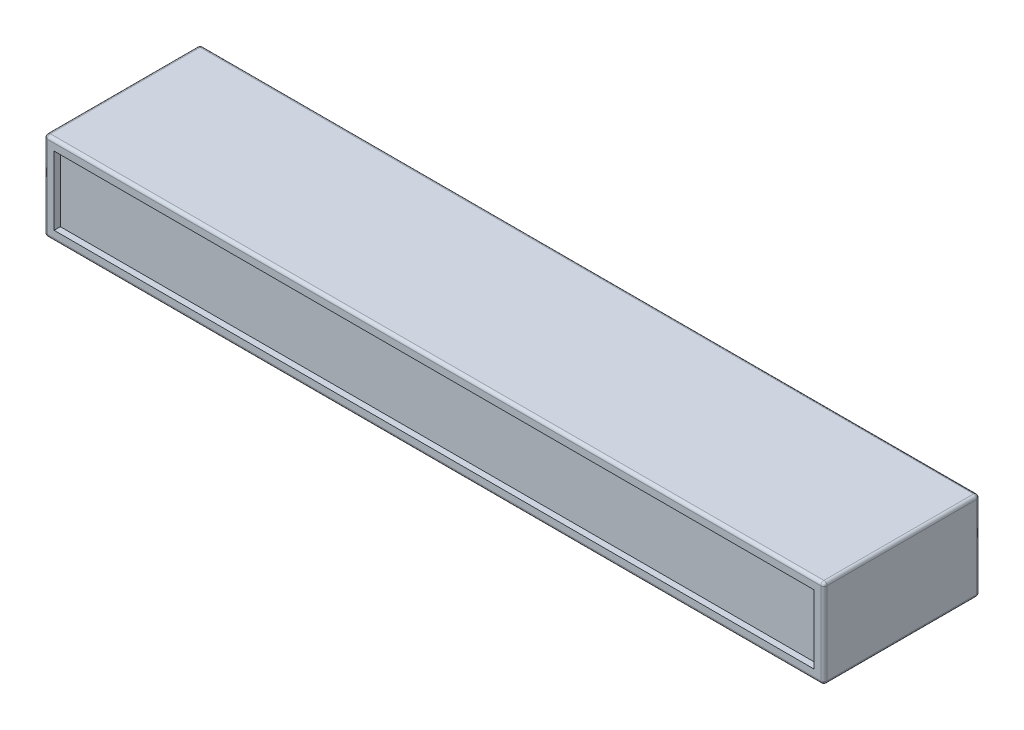
from build123d import *

# Parameters (mm, degrees)
SKETCH1_W           = 2500
SKETCH1_H           = 284
BOSS_EXTRUDE1_DEPTH = 500
FILLET1_R           = 10
SKETCH2_W           = 2436
SKETCH2_H           = 220
CUT_EXTRUDE1_DEPTH  = 20


with BuildPart() as part:
    # Sketch1 → Boss-Extrude1 (new body)
    with BuildSketch(Plane.XY):
        with Locations((1250, 142)):
            Rectangle(SKETCH1_W, SKETCH1_H)
    extrude(amount=BOSS_EXTRUDE1_DEPTH)

    # Fillet1
    fillet1_edges = [part.edges().sort_by_distance(p)[0] for p in [
        (2500, 142, 500),
        (1250, 284, 500),
        (0, 142, 500),
        (1250, 284, 0),
        (2500, 142, 0),
        (1250, 0, 0),
        (0, 142, 0),
        (0, 284, 250),
        (2500, 284, 250),
        (2500, 0, 250),
        (0, 0, 250),
        (1250, 0, 500),
    ]]
    fillet(fillet1_edges, radius=FILLET1_R)

    # Sketch2 → Cut-Extrude1 (cut)
    with BuildSketch(Plane.XY.offset(500)):
        with Locations((1250, 142)):
            Rectangle(SKETCH2_W, SKETCH2_H)
    extrude(amount=-CUT_EXTRUDE1_DEPTH, mode=Mode.SUBTRACT)


solid = part.part
